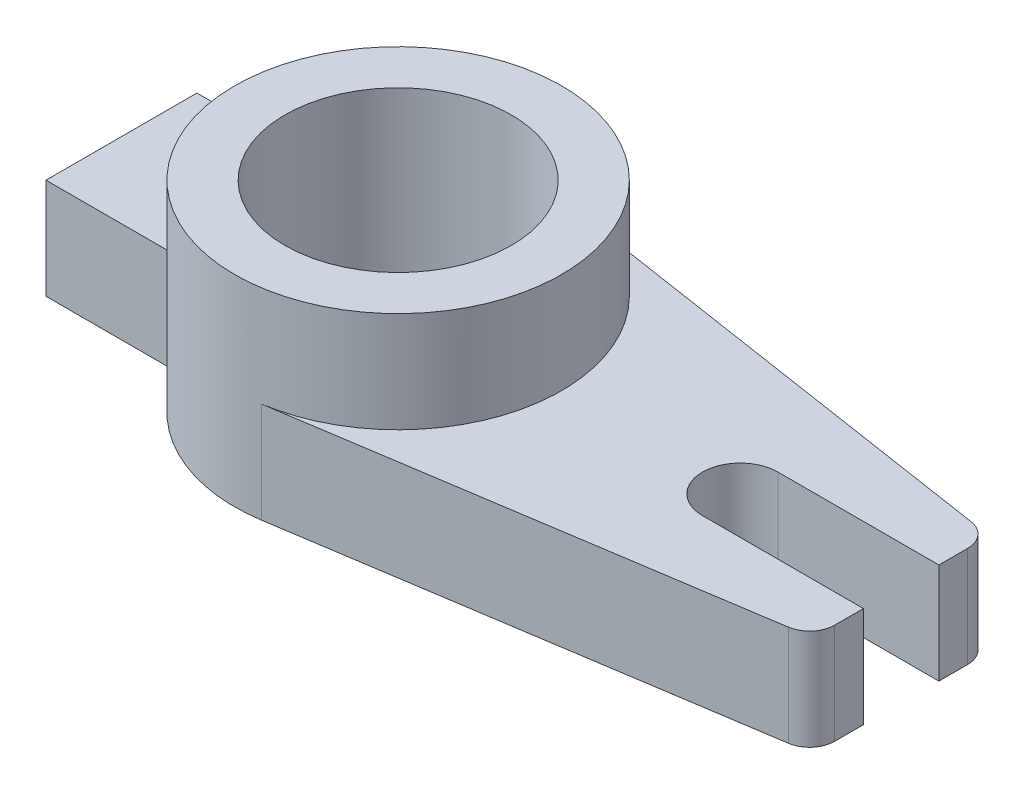
from build123d import *

# Parameters (mm, degrees)
SKETCH1_R           = 22.5
BOSS_EXTRUDE1_DEPTH = 20
SKETCH1_3_R         = 22.5
BOSS_EXTRUDE2_DEPTH = 40


with BuildPart() as part:
    # Sketch1 → Boss-Extrude1 (new body)
    with BuildSketch(Plane(origin=(0, 0, 0), x_dir=(1, 0, 0), z_dir=(0, 1, 0))):
        with BuildLine():
            Line((-55, -15), (-28.831406487, -15))
            ThreePointArc((-28.831406487, -15), (-14.696219934, -28.987430373), (4.941115981, -32.122194397))
            Line((4.941115981, -32.122194397), (95.760171689, -18.152180955))
            ThreePointArc((95.760171689, -18.152180955), (98.794789747, -16.466003095), (100, -13.210304894))
            Line((100, -13.210304894), (100, -7.5))
            Line((100, -7.5), (68, -7.5))
            ThreePointArc((68, -7.5), (60.5, 0), (68, 7.5))
            Line((68, 7.5), (100, 7.5))
            Line((100, 7.5), (100, 13.210304894))
            ThreePointArc((100, 13.210304894), (98.794789747, 16.466003095), (95.760171689, 18.152180955))
            Line((95.760171689, 18.152180955), (4.941115981, 32.122194397))
            ThreePointArc((4.941115981, 32.122194397), (-14.696219934, 28.987430373), (-28.831406487, 15))
            Line((-28.831406487, 15), (-55, 15))
            Line((-55, 15), (-55, -15))
        make_face()
        Circle(SKETCH1_R, mode=Mode.SUBTRACT)
    extrude(amount=BOSS_EXTRUDE1_DEPTH)

    # Sketch1<3> → Boss-Extrude2 (add)
    with BuildSketch(Plane(origin=(0, 0, 0), x_dir=(1, 0, 0), z_dir=(0, 1, 0))):
        with BuildLine():
            ThreePointArc((-28.831406487, 15), (-32.5, 0), (-28.831406487, -15))
            ThreePointArc((-28.831406487, -15), (-14.696219934, -28.987430373), (4.941115981, -32.122194397))
            ThreePointArc((4.941115981, -32.122194397), (24.666133355, -21.162038307), (32.5, 0))
            ThreePointArc((32.5, 0), (24.666133355, 21.162038307), (4.941115981, 32.122194397))
            ThreePointArc((4.941115981, 32.122194397), (-14.696219934, 28.987430373), (-28.831406487, 15))
        make_face()
        Circle(SKETCH1_3_R, mode=Mode.SUBTRACT)
    extrude(amount=BOSS_EXTRUDE2_DEPTH)


solid = part.part
